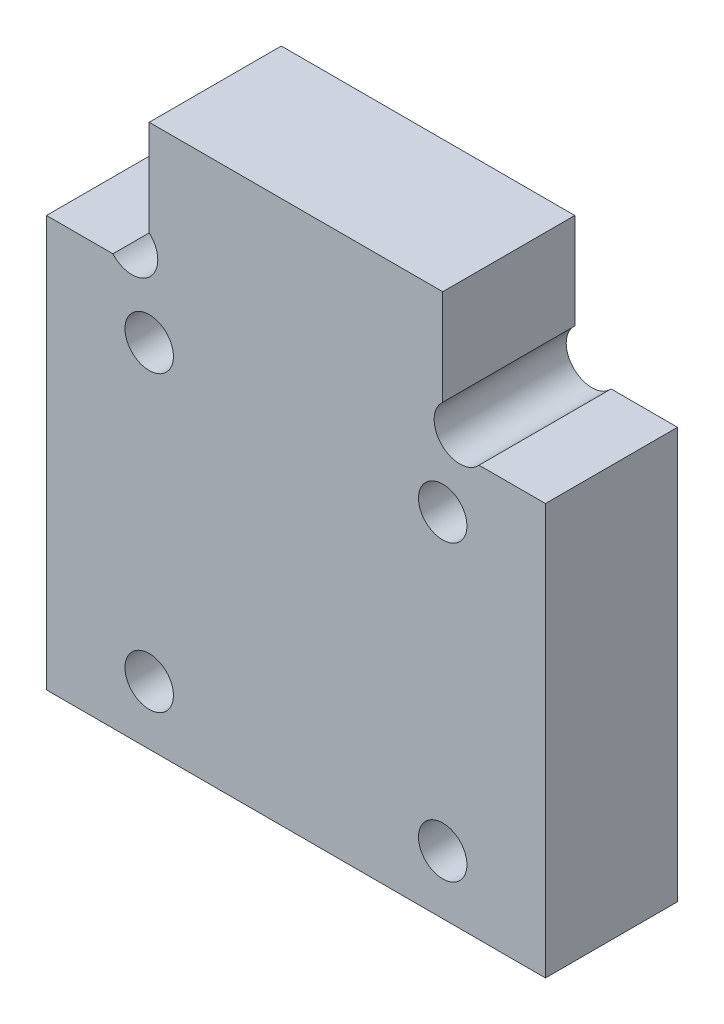
from build123d import *

# Parameters (mm, degrees)
ESQUISSE1_W                  = 34
ESQUISSE1_H                  = 28
BOSS_EXTRU_1_DEPTH           = 9
ESQUISSE2_W                  = 20
ESQUISSE2_H                  = 9
BOSS_EXTRU_2_DEPTH           = 9
ENL_V_MAT_EXTRU_1_DEPTH      = 52.048996072
ENL_V_MAT_EXTRU_1_DEPTH_BACK = 52.048996072
ENL_V_MAT_EXTRU_2_DEPTH      = 52.048996072
ENL_V_MAT_EXTRU_2_DEPTH_BACK = 52.048996072
ESQUISSE4_R                  = 1.65


with BuildPart() as part:
    # Esquisse1 → Boss.-Extru.1 (new body)
    with BuildSketch(Plane.XY):
        with Locations((17, 14)):
            Rectangle(ESQUISSE1_W, ESQUISSE1_H)
    extrude(amount=BOSS_EXTRU_1_DEPTH)

    # Esquisse2 → Boss.-Extru.2 (add)
    with BuildSketch(Plane.XY.offset(9)):
        with Locations((17, 32.5)):
            Rectangle(ESQUISSE2_W, ESQUISSE2_H)
    extrude(amount=-BOSS_EXTRU_2_DEPTH)

    # Esquisse3 → Enlèv. mat.-Extru.1 (cut, two sides: drawn at the far end of the back side and taken through both)
    with BuildSketch(Plane.XY.offset(9).offset(-ENL_V_MAT_EXTRU_1_DEPTH_BACK)):
        with BuildLine():
            Line((4.525126266, 28), (7, 30.474873734))
            ThreePointArc((7, 30.474873734), (7.070710678, 27.929289322), (4.525126266, 28))
        make_face()
        with BuildLine():
            Line((29.474873734, 28), (27, 30.474873734))
            ThreePointArc((27, 30.474873734), (26.929289322, 27.929289322), (29.474873734, 28))
        make_face()
    extrude(amount=ENL_V_MAT_EXTRU_1_DEPTH + ENL_V_MAT_EXTRU_1_DEPTH_BACK, mode=Mode.SUBTRACT)

    # Esquisse4 → Enlèv. mat.-Extru.2 (cut, two sides: drawn at the far end of the back side and taken through both)
    with BuildSketch(Plane.XY.offset(9).offset(-ENL_V_MAT_EXTRU_2_DEPTH_BACK)):
        with Locations((7, 24)):
            Circle(ESQUISSE4_R)
        with Locations(Location((27, 24, 0), (0, 0, 180))):
            Circle(ESQUISSE4_R)
        with Locations((27, 4)):
            Circle(ESQUISSE4_R)
        with Locations(Location((7, 4, 0), (0, 0, 180))):
            Circle(ESQUISSE4_R)
    extrude(amount=ENL_V_MAT_EXTRU_2_DEPTH + ENL_V_MAT_EXTRU_2_DEPTH_BACK, mode=Mode.SUBTRACT)


solid = part.part
